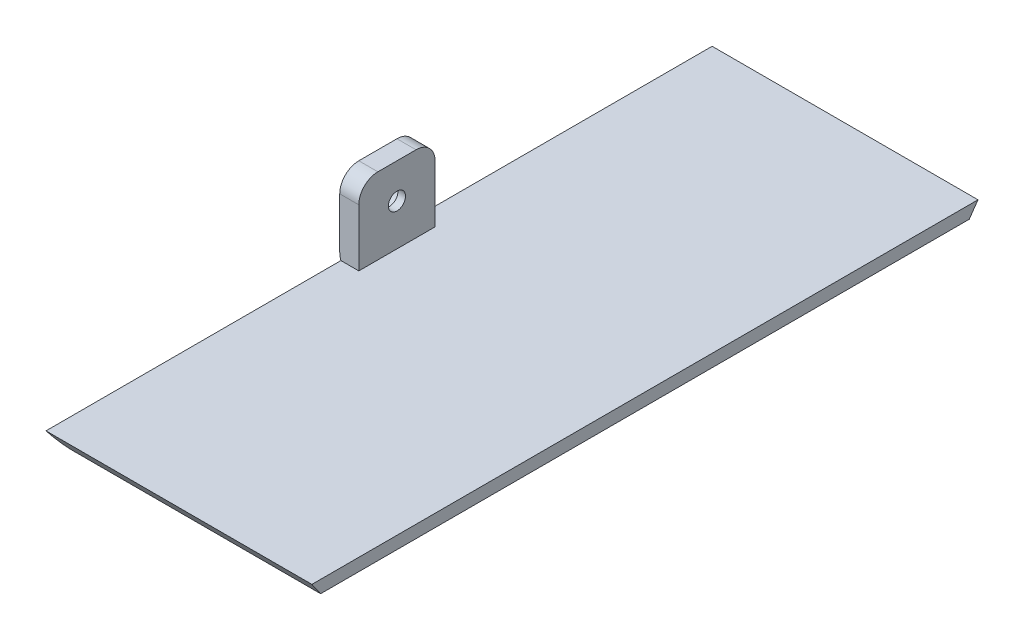
from build123d import *

# Parameters (mm, degrees)
BOSS_EXTRUDE1_DEPTH     = 70
SKETCH4_W               = 5
SKETCH4_H               = 20
BOSS_EXTRUDE2_DEPTH     = 20
CUT_EXTRUDE2_DEPTH      = 114.967153248
CUT_EXTRUDE2_DEPTH_BACK = 114.967153248
CUT_EXTRUDE3_REACH      = 115.967
SKETCH6_R               = 2.25
SKETCH7_R               = 3.75
CUT_EXTRUDE4_DEPTH      = 3
FILLET1_R               = 5


with BuildPart() as part:
    # Sketch1 → Boss-Extrude1 (new body)
    with BuildSketch(Plane.YZ):
        Polygon((-1.638304089, 85), (1.638304089, 87.294305745), (1.638304089, -87.294305745), (-1.638304089, -85), align=None)
    extrude(amount=BOSS_EXTRUDE1_DEPTH)

    # Sketch4 → Boss-Extrude2 (add)
    with BuildSketch(Plane(origin=(0, 1.638304089, 0), x_dir=(-1, 0, 0), z_dir=(0, 1, 0))):
        with Locations((-2.5, 0)):
            Rectangle(SKETCH4_W, SKETCH4_H)
    extrude(amount=BOSS_EXTRUDE2_DEPTH)

    # Sketch5 → Cut-Extrude2 (cut, two sides: drawn at the far end of the back side and taken through both)
    with BuildSketch(Plane(origin=(0, 0, 0), x_dir=(0, 1, 0), z_dir=(0, 0, 1)).offset(-CUT_EXTRUDE2_DEPTH_BACK)):
        with BuildLine():
            ThreePointArc((3.361695911, 0), (-0.173837995, -1.464466094), (-1.638304089, -5))
            Line((-1.638304089, -5), (-1.638304089, 0))
            Line((-1.638304089, 0), (3.361695911, 0))
        make_face()
    extrude(amount=CUT_EXTRUDE2_DEPTH + CUT_EXTRUDE2_DEPTH_BACK, mode=Mode.SUBTRACT)

    # Sketch6 → Cut-Extrude3 (cut, up to next)
    with BuildSketch(Plane(origin=(0, 0, 0), x_dir=(0, -1, 0), z_dir=(-1, 0, 0)), mode=Mode.PRIVATE) as cut_extrude3_sk1:
        with Locations(Location((-12.5, 0, 0), (0, 0, 90))):
            Circle(SKETCH6_R)
    cut_extrude3_tool1 = extrude(cut_extrude3_sk1.sketch, amount=-CUT_EXTRUDE3_REACH, mode=Mode.PRIVATE) & part.part
    add(cut_extrude3_tool1.solids().sort_by_distance((0, 12.5, 0))[0], mode=Mode.SUBTRACT)

    # Sketch7 → Cut-Extrude4 (cut)
    with BuildSketch(Plane(origin=(0, 0, 0), x_dir=(0, -1, 0), z_dir=(-1, 0, 0))):
        with Locations(Location((-12.5, 0, 0), (0, 0, 90))):
            Circle(SKETCH7_R)
    extrude(amount=-CUT_EXTRUDE4_DEPTH, mode=Mode.SUBTRACT)

    # Fillet1
    fillet1_edges = [part.edges().sort_by_distance(p)[0] for p in [
        (2.5, 21.638304089, -10),
        (2.5, 21.638304089, 10),
    ]]
    fillet(fillet1_edges, radius=FILLET1_R)


solid = part.part
